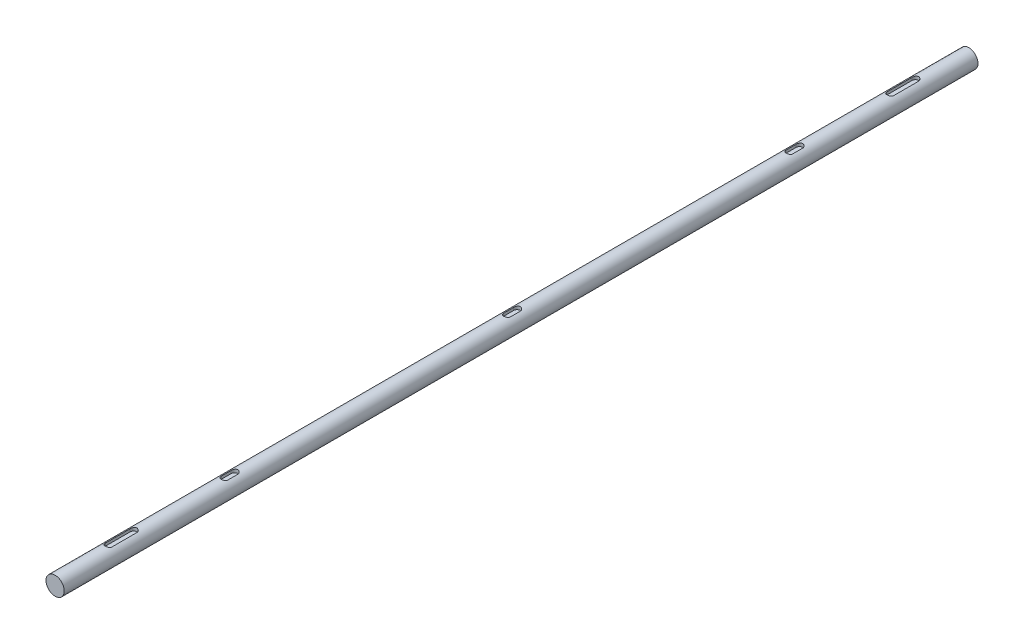
from build123d import *

# Parameters (mm, degrees)
SKETCH_1_R          = 5.5
EXTRUDE_1_DEPTH     = 275
CUT_EXTRUDE_1_DEPTH = 2
CUT_EXTRUDE_2_DEPTH = 2
CUT_EXTRUDE_3_DEPTH = 2


with BuildPart() as part:
    # 草图1 → 凸台-拉伸1 (new, symmetric)
    with BuildSketch(Plane.XY):
        Circle(SKETCH_1_R)
    extrude(amount=EXTRUDE_1_DEPTH, both=True)

    # 草图2 → 切除-拉伸1 (cut)
    with BuildSketch(Plane(origin=(0, 5.5, 0), x_dir=(1, 0, 0), z_dir=(0, 1, 0))):
        with BuildLine():
            Line((2, 3), (2, -3))
            ThreePointArc((2, -3), (0, -5), (-2, -3))
            Line((-2, -3), (-2, 3))
            ThreePointArc((-2, 3), (0, 5), (2, 3))
        make_face()
    extrude(amount=-CUT_EXTRUDE_1_DEPTH, mode=Mode.SUBTRACT)

    # 草图3 → 切除-拉伸2 (cut)
    with BuildSketch(Plane(origin=(0, 5.5, 0), x_dir=(1, 0, 0), z_dir=(0, 1, 0))):
        with BuildLine():
            Line((2, 173), (2, 167))
            ThreePointArc((2, 167), (0, 165), (-2, 167))
            Line((-2, 167), (-2, 173))
            ThreePointArc((-2, 173), (0, 175), (2, 173))
        make_face()
        with BuildLine():
            Line((2, -173), (2, -167))
            ThreePointArc((2, -167), (0, -165), (-2, -167))
            Line((-2, -167), (-2, -173))
            ThreePointArc((-2, -173), (0, -175), (2, -173))
        make_face()
    extrude(amount=-CUT_EXTRUDE_2_DEPTH, mode=Mode.SUBTRACT)

    # 草图4 → 切除-拉伸3 (cut)
    with BuildSketch(Plane(origin=(0, 5.5, 0), x_dir=(1, 0, 0), z_dir=(0, 1, 0))):
        with BuildLine():
            Line((-2, -242.77797753), (-2, -227.77797753))
            ThreePointArc((-2, -227.77797753), (0, -225.77797753), (2, -227.77797753))
            Line((2, -227.77797753), (2, -242.77797753))
            ThreePointArc((2, -242.77797753), (0, -244.77797753), (-2, -242.77797753))
        make_face()
        with BuildLine():
            Line((-2, 242.77797753), (-2, 227.77797753))
            ThreePointArc((-2, 227.77797753), (0, 225.77797753), (2, 227.77797753))
            Line((2, 227.77797753), (2, 242.77797753))
            ThreePointArc((2, 242.77797753), (0, 244.77797753), (-2, 242.77797753))
        make_face()
    extrude(amount=-CUT_EXTRUDE_3_DEPTH, mode=Mode.SUBTRACT)


solid = part.part
